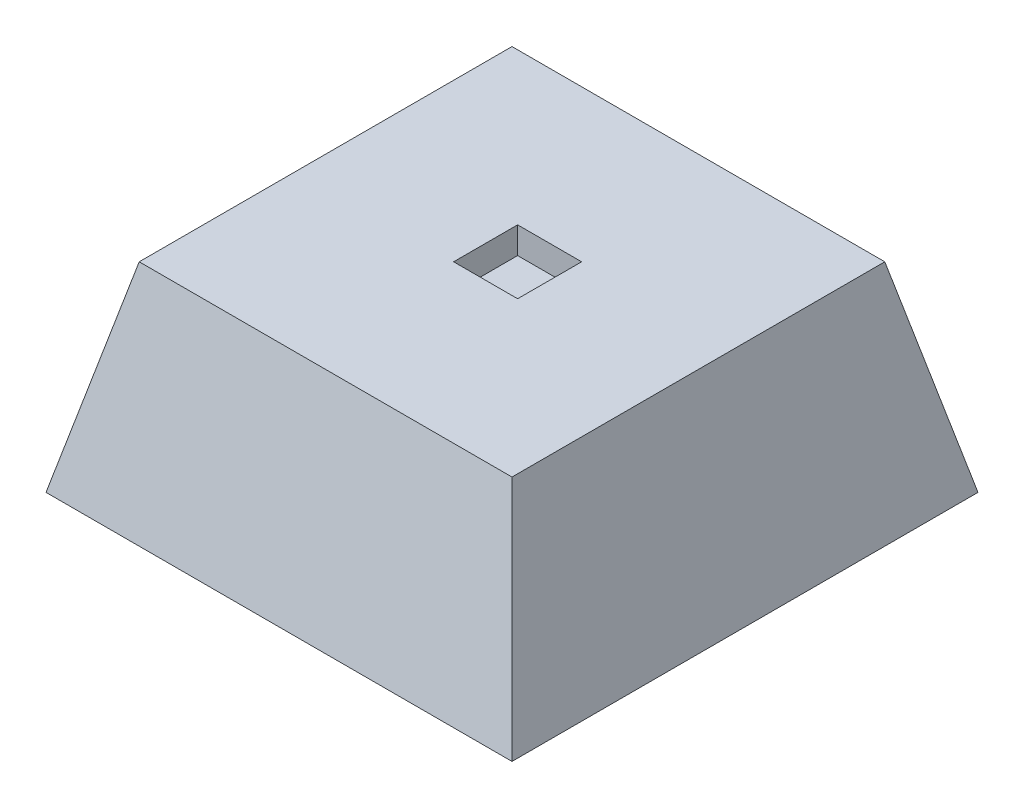
from build123d import *

# Parameters (mm, degrees)
SKETCH1_W           = 7
SKETCH1_H           = 7
BOSS_EXTRUDE1_DEPTH = 3
CUT_EXTRUDE1_DEPTH  = 7
CUT_EXTRUDE2_DEPTH  = 11
SKETCH4_R           = 1.8
CUT_EXTRUDE3_DEPTH  = 0.8
SKETCH5_W           = 0.961538462
SKETCH5_H           = 0.961538462
CUT_EXTRUDE4_DEPTH  = 0.4


with BuildPart() as part:
    # Sketch1 → Boss-Extrude1 (new body)
    with BuildSketch(Plane(origin=(0, 0, 0), x_dir=(1, 0, 0), z_dir=(0, 1, 0))):
        with Locations((3.5, 3.5)):
            Rectangle(SKETCH1_W, SKETCH1_H)
    extrude(amount=BOSS_EXTRUDE1_DEPTH)

    # Sketch2 → Cut-Extrude1 (cut)
    with BuildSketch(Plane.XY):
        Polygon((0, 0), (0.7, 3), (0, 3), align=None)
        Polygon((7, 0), (6.3, 3), (7, 3), align=None)
    extrude(amount=-CUT_EXTRUDE1_DEPTH, mode=Mode.SUBTRACT)

    # Sketch3 → Cut-Extrude2 (cut)
    with BuildSketch(Plane(origin=(0, 0, 0), x_dir=(0, 0, -1), z_dir=(1, 0, 0))):
        Polygon((0, 0), (0.7, 3), (0, 3), align=None)
        Polygon((7, 3), (6.3, 3), (7, 0), align=None)
    extrude(amount=CUT_EXTRUDE2_DEPTH, mode=Mode.SUBTRACT)

    # Sketch4 → Cut-Extrude3 (cut)
    with BuildSketch(Plane.XZ):
        with Locations(Location((3.5, -3.5, 0), (0, 0, 270))):
            Circle(SKETCH4_R)
    extrude(amount=-CUT_EXTRUDE3_DEPTH, mode=Mode.SUBTRACT)

    # Sketch5 → Cut-Extrude4 (cut)
    with BuildSketch(Plane(origin=(0, 3, 0), x_dir=(1, 0, 0), z_dir=(0, 1, 0))):
        with Locations((3.542267308, 3.542216335)):
            Rectangle(SKETCH5_W, SKETCH5_H)
    extrude(amount=-CUT_EXTRUDE4_DEPTH, mode=Mode.SUBTRACT)


solid = part.part
